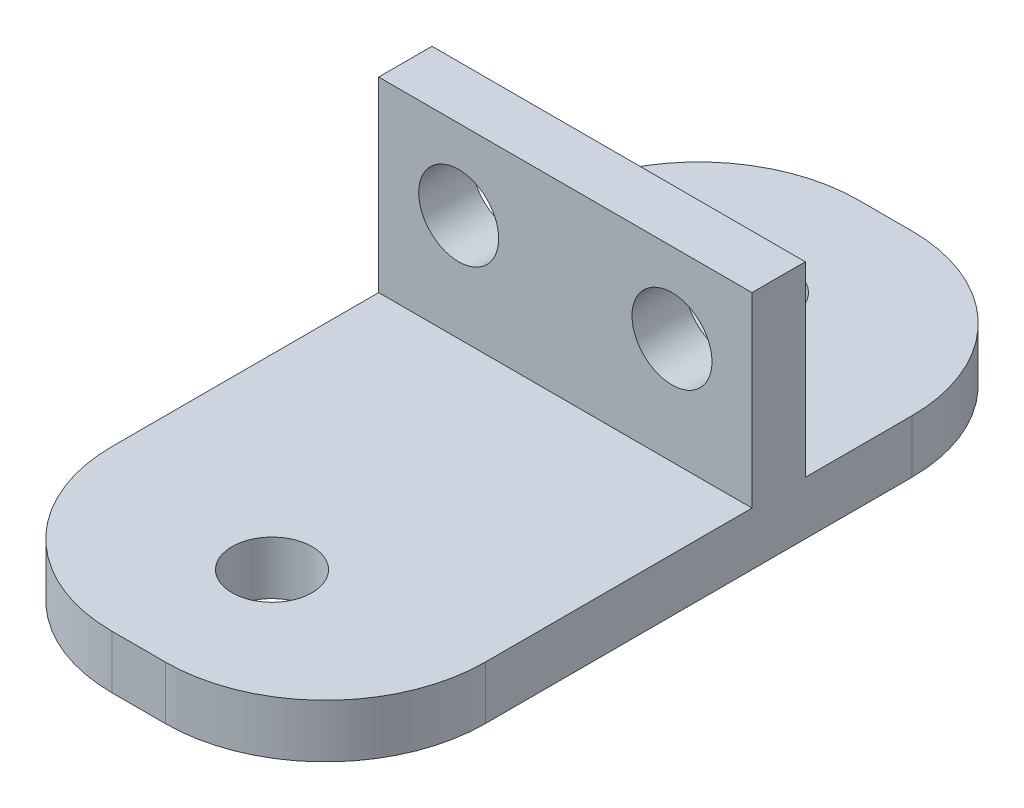
from build123d import *

# Parameters (mm, degrees)
SKETCH_1_W          = 14
SKETCH_1_H          = 28
EXTRUDE_1_DEPTH     = 2
SKETCH_2_R          = 1.5
CUT_EXTRUDE_1_DEPTH = 2
SKETCH_3_W          = 14
SKETCH_3_H          = 2
EXTRUDE_2_DEPTH     = 7
FILLET_1_R          = 6
SKETCH_4_R          = 1.5
CUT_EXTRUDE_2_DEPTH = 15


with BuildPart() as part:
    # Эскиз1 → Бобышка-Вытянуть1 (new body)
    with BuildSketch(Plane.XZ):
        with Locations((7, -14)):
            Rectangle(SKETCH_1_W, SKETCH_1_H)
    extrude(amount=EXTRUDE_1_DEPTH)

    # Эскиз2 → Вырез-Вытянуть1 (cut)
    with BuildSketch(Plane.XZ.offset(2)):
        with Locations(Location((7, -5, 0), (0, 0, 270))):
            Circle(SKETCH_2_R)
        with Locations(Location((7, -23, 0), (0, 0, 270))):
            Circle(SKETCH_2_R)
    extrude(amount=-CUT_EXTRUDE_1_DEPTH, mode=Mode.SUBTRACT)

    # Эскиз3 → Бобышка-Вытянуть2 (add)
    with BuildSketch(Plane(origin=(0, 0, 0), x_dir=(1, 0, 0), z_dir=(0, 1, 0))):
        with Locations((7, 17)):
            Rectangle(SKETCH_3_W, SKETCH_3_H)
    extrude(amount=EXTRUDE_2_DEPTH)

    # Скругление1
    fillet_1_edges = [part.edges().sort_by_distance(p)[0] for p in [
        (0, -1, 0),
        (14, -1, 0),
        (14, -1, -28),
        (0, -1, -28),
    ]]
    fillet(fillet_1_edges, radius=FILLET_1_R)

    # Эскиз4 → Вырез-Вытянуть2 (cut)
    with BuildSketch(Plane(origin=(0, 0, -18), x_dir=(-1, 0, 0), z_dir=(0, 0, -1))):
        with Locations((-11, 4)):
            Circle(SKETCH_4_R)
        with Locations((-3, 4)):
            Circle(SKETCH_4_R)
    extrude(amount=-CUT_EXTRUDE_2_DEPTH, mode=Mode.SUBTRACT)


solid = part.part
